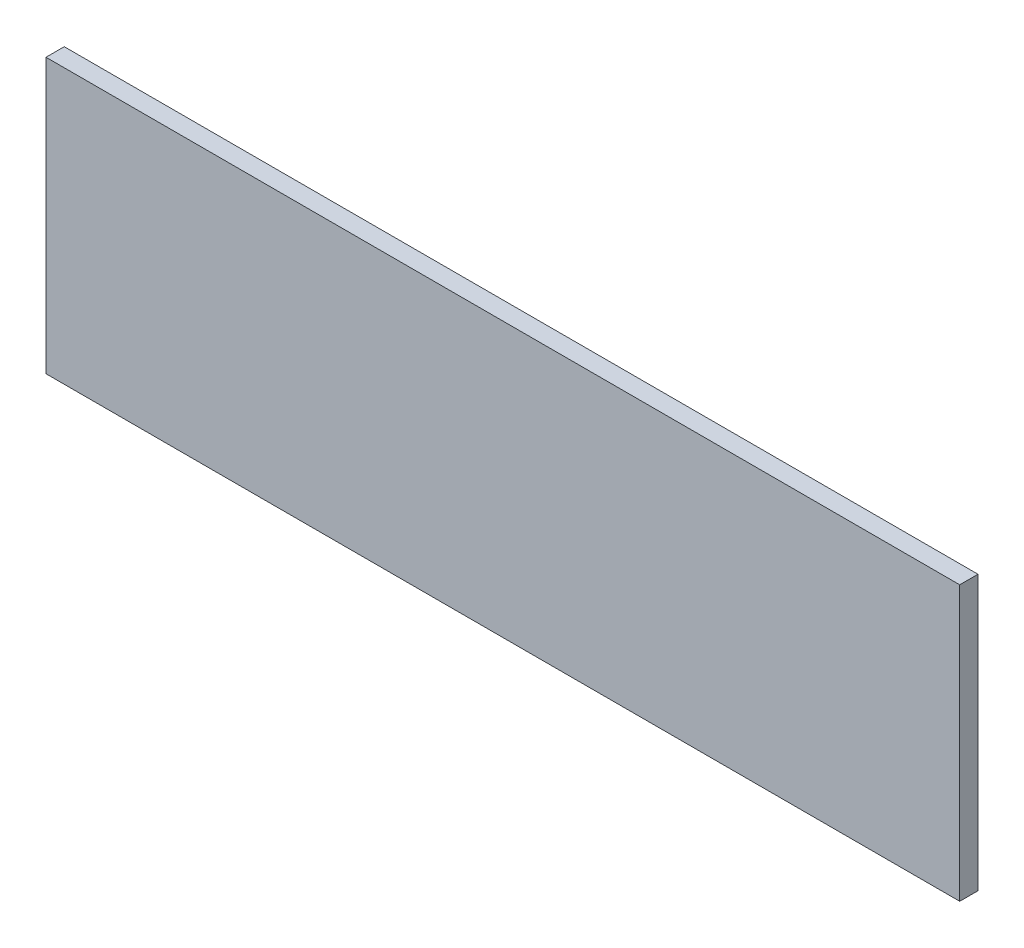
from build123d import *

# Parameters (mm, degrees)
SKETCH1_W           = 500
SKETCH1_H           = 150
BOSS_EXTRUDE1_DEPTH = 10


with BuildPart() as part:
    # Sketch1 → Boss-Extrude1 (new body)
    with BuildSketch(Plane.XY):
        with Locations((72.020725389, 19.041450777)):
            Rectangle(SKETCH1_W, SKETCH1_H)
    extrude(amount=BOSS_EXTRUDE1_DEPTH)


solid = part.part
